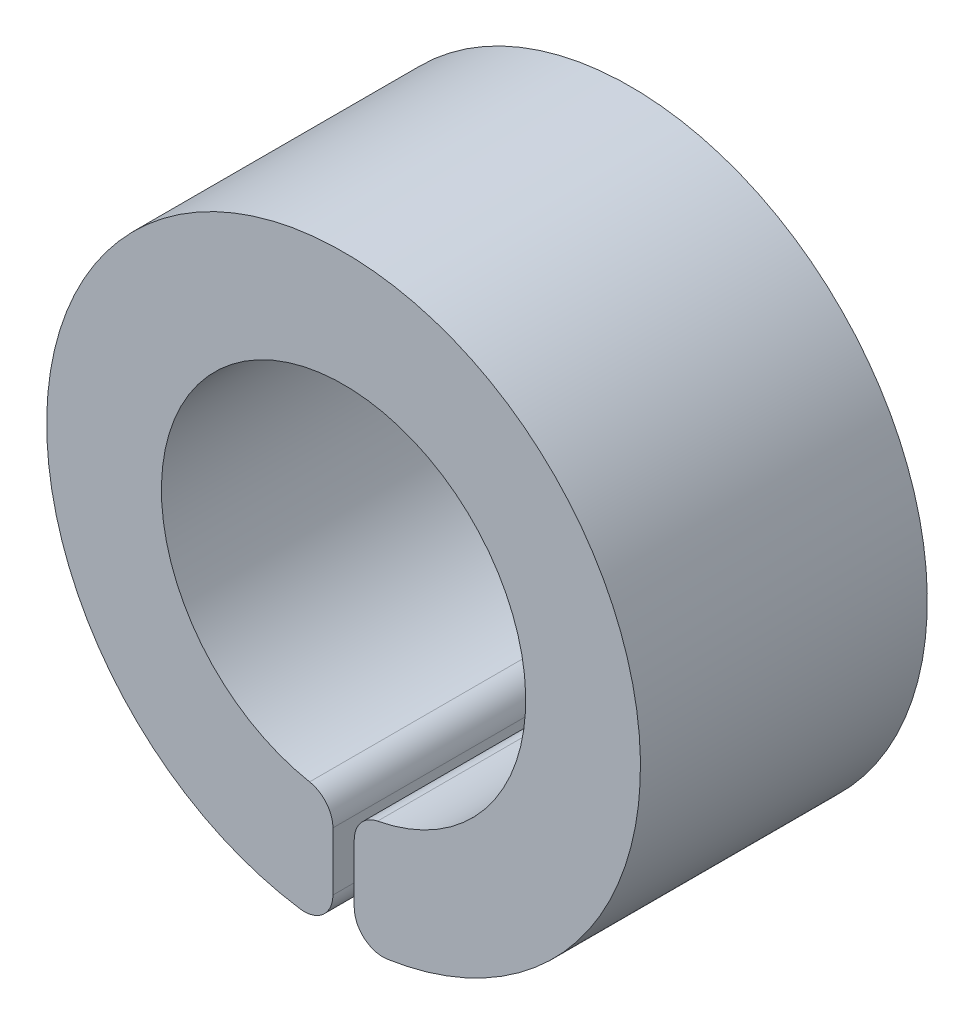
from build123d import *

# Parameters (mm, degrees)
SKETCH1_R           = 5.175
SKETCH1_R_2         = 3.175
BOSS_EXTRUDE1_DEPTH = 5
SKETCH5_W           = 0.371171222
SKETCH5_H           = 5
CUT_EXTRUDE1_DEPTH  = 20
FILLET1_R           = 0.5


with BuildPart() as part:
    # Sketch1 → Boss-Extrude1 (new body)
    with BuildSketch(Plane.XY):
        Circle(SKETCH1_R)
        Circle(SKETCH1_R_2, mode=Mode.SUBTRACT)
    extrude(amount=BOSS_EXTRUDE1_DEPTH)

    # Sketch5 → Cut-Extrude1 (cut)
    with BuildSketch(Plane(origin=(0, 0, 0), x_dir=(1, 0, 0), z_dir=(0, 1, 0))):
        with Locations((0, -2.5)):
            Rectangle(SKETCH5_W, SKETCH5_H)
    extrude(amount=-CUT_EXTRUDE1_DEPTH, mode=Mode.SUBTRACT)

    # Fillet1
    fillet1_edges = [part.edges().sort_by_distance(p)[0] for p in [
        (0.185585611, -3.169571419, 2.5),
        (-0.185585611, -3.169571419, 2.5),
        (-0.185585611, -5.171671198, 2.5),
        (0.185585611, -5.171671198, 2.5),
    ]]
    fillet(fillet1_edges, radius=FILLET1_R)


solid = part.part
